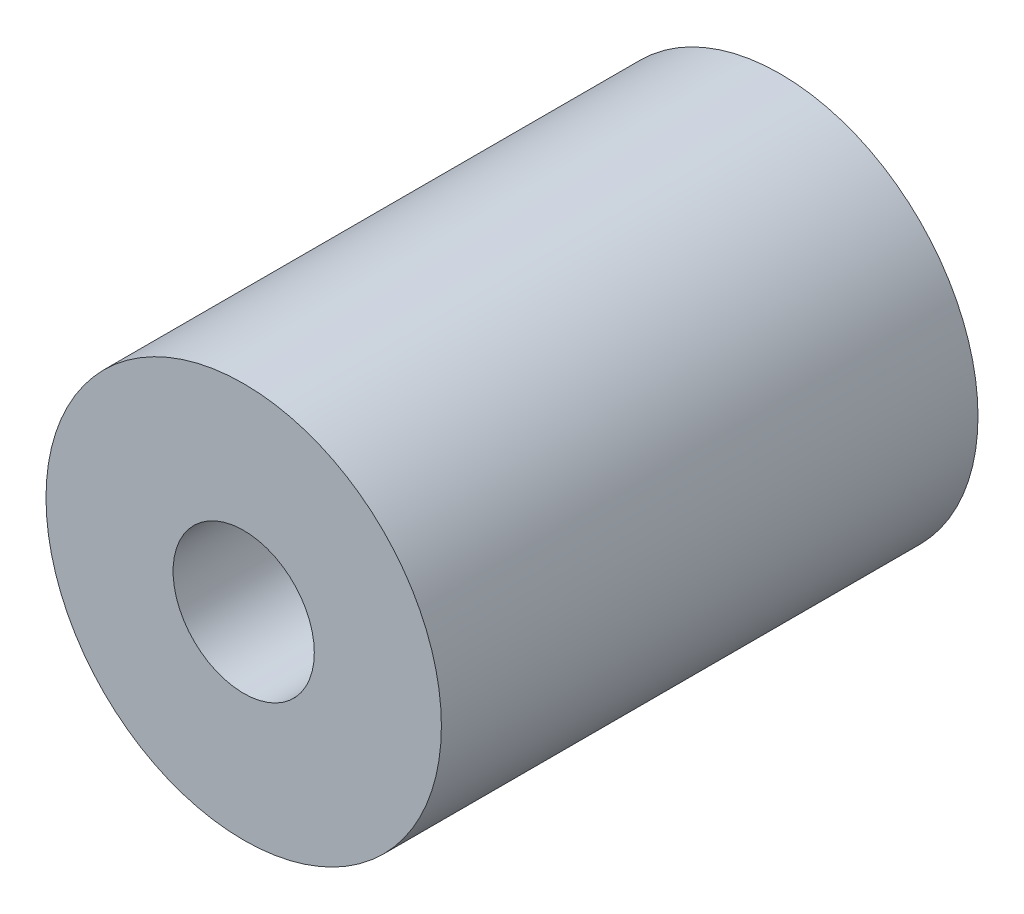
from build123d import *

# Parameters (mm, degrees)
SKETCH_1_R      = 14
SKETCH_1_R_2    = 5
EXTRUDE_1_DEPTH = 38


with BuildPart() as part:
    # 草图1 → 凸台-拉伸1 (new body)
    with BuildSketch(Plane.XY):
        Circle(SKETCH_1_R)
        Circle(SKETCH_1_R_2, mode=Mode.SUBTRACT)
    extrude(amount=EXTRUDE_1_DEPTH)


solid = part.part
